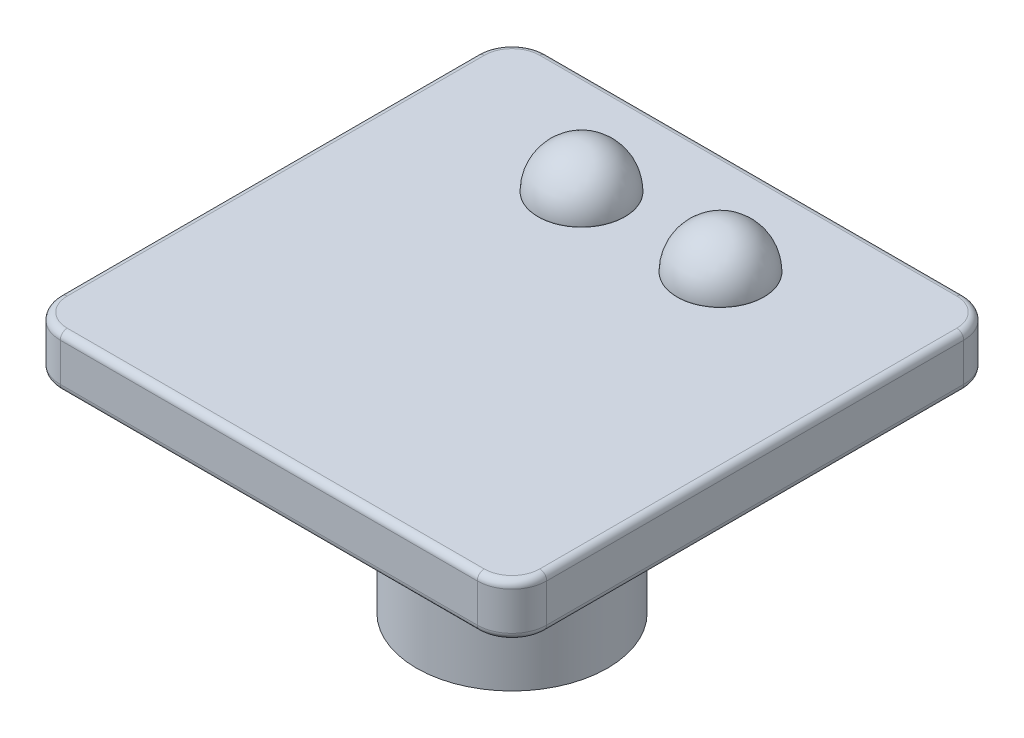
from build123d import *

# Parameters (mm, degrees)
BOSS_EXTRUDE1_DEPTH = 1.5
SKETCH2_R           = 2.75
BOSS_EXTRUDE2_DEPTH = 6
SKETCH3_W           = 1.1
SKETCH3_H           = 1.45
SKETCH3_W_2         = 1.45
SKETCH3_H_2         = 1.1
CUT_EXTRUDE1_DEPTH  = 6
CHAMFER1_SIZE       = 0.3
FILLET1_R           = 1
SKETCH4_R           = 1.25
BOSS_EXTRUDE3_DEPTH = 0.01
DOME1_FACE_RADIUS   = 1.25
DOME1_HEIGHT        = 1.25
DOME2_FACE_RADIUS   = 1.25
DOME2_HEIGHT        = 1.25
FILLET3_R           = 0.2


with BuildPart() as part:
    # Sketch1 → Boss-Extrude1 (new body)
    with BuildSketch(Plane(origin=(0, 0, 0), x_dir=(1, 0, 0), z_dir=(0, 1, 0))):
        with BuildLine():
            Line((-7.324675649, 4.396717546), (4.675324351, 4.396717546))
            ThreePointArc((4.675324351, 4.396717546), (5.382431132, 4.103824327), (5.675324351, 3.396717546))
            Line((5.675324351, 3.396717546), (5.675324351, -8.603282454))
            ThreePointArc((5.675324351, -8.603282454), (5.382431132, -9.310389235), (4.675324351, -9.603282454))
            Line((4.675324351, -9.603282454), (-7.324675649, -9.603282454))
            ThreePointArc((-7.324675649, -9.603282454), (-8.03178243, -9.310389235), (-8.324675649, -8.603282454))
            Line((-8.324675649, -8.603282454), (-8.324675649, 3.396717546))
            ThreePointArc((-8.324675649, 3.396717546), (-8.03178243, 4.103824327), (-7.324675649, 4.396717546))
        make_face()
    extrude(amount=BOSS_EXTRUDE1_DEPTH)

    # Sketch2 → Boss-Extrude2 (add)
    with BuildSketch(Plane.XZ):
        with Locations(Location((-1.324675649, 2.603282454, 0), (0, 0, 270))):
            Circle(SKETCH2_R)
    extrude(amount=BOSS_EXTRUDE2_DEPTH)

    # Sketch3 → Cut-Extrude1 (cut)
    with BuildSketch(Plane.XZ.offset(6)):
        with Locations((-1.324675649, 3.878282454)):
            Rectangle(SKETCH3_W, SKETCH3_H)
        with Locations((-0.049675649, 2.603282454)):
            Rectangle(SKETCH3_W_2, SKETCH3_H_2)
        with Locations((-1.324675649, 2.603282454)):
            Rectangle(SKETCH3_W, SKETCH3_H_2)
        with Locations((-2.599675649, 2.603282454)):
            Rectangle(SKETCH3_W_2, SKETCH3_H_2)
        with Locations((-1.324675649, 1.328282454)):
            Rectangle(SKETCH3_W, SKETCH3_H)
    extrude(amount=-CUT_EXTRUDE1_DEPTH, mode=Mode.SUBTRACT)

    # Chamfer1
    chamfer1_edges = [part.edges().sort_by_distance(p)[0] for p in [
        (-0.774675649, -6, 3.878282454),
        (-0.049675649, -6, 3.153282454),
        (0.675324351, -6, 2.603282454),
        (-0.774675649, -6, 1.328282454),
        (-2.599675649, -6, 3.153282454),
        (-1.324675649, -6, 4.603282454),
        (-1.874675649, -6, 3.878282454),
        (-3.324675649, -6, 2.603282454),
        (-2.599675649, -6, 2.053282454),
        (-1.874675649, -6, 1.328282454),
        (-1.324675649, -6, 0.603282454),
        (-0.049675649, -6, 2.053282454),
    ]]
    chamfer(chamfer1_edges, length=CHAMFER1_SIZE)

    # Fillet1
    fillet1_edges = [part.edges().sort_by_distance(p)[0] for p in [
        (-1.324675649, 0, 5.353282454),
    ]]
    fillet(fillet1_edges, radius=FILLET1_R)

    # Sketch4 → Boss-Extrude3 (add)
    with BuildSketch(Plane(origin=(0, 1.5, 0), x_dir=(1, 0, 0), z_dir=(0, 1, 0))):
        with Locations(Location((-3.324675649, 1.396717546, 0), (0, 0, 90))):
            Circle(SKETCH4_R)
        with Locations(Location((0.675324351, 1.396717546, 0), (0, 0, 90))):
            Circle(SKETCH4_R)
    extrude(amount=BOSS_EXTRUDE3_DEPTH)

    # Dome1: a dome of height H over a round flat face of radius A is a cap of a sphere of radius (A * A + H * H) / (2 * H)
    dome1_r = (DOME1_FACE_RADIUS * DOME1_FACE_RADIUS + DOME1_HEIGHT * DOME1_HEIGHT) / (2 * DOME1_HEIGHT)
    dome1_base = Plane((-3.324675649, 1.51, -1.396717546), z_dir=(0, 1, 0))
    with Locations(dome1_base.offset(DOME1_HEIGHT - dome1_r)):
        dome1_ball = Sphere(dome1_r, mode=Mode.PRIVATE)
    add(split(dome1_ball, bisect_by=dome1_base, keep=Keep.TOP, mode=Mode.PRIVATE))

    # Dome2: a dome of height H over a round flat face of radius A is a cap of a sphere of radius (A * A + H * H) / (2 * H)
    dome2_r = (DOME2_FACE_RADIUS * DOME2_FACE_RADIUS + DOME2_HEIGHT * DOME2_HEIGHT) / (2 * DOME2_HEIGHT)
    dome2_base = Plane((0.675324351, 1.51, -1.396717546), z_dir=(0, 1, 0))
    with Locations(dome2_base.offset(DOME2_HEIGHT - dome2_r)):
        dome2_ball = Sphere(dome2_r, mode=Mode.PRIVATE)
    add(split(dome2_ball, bisect_by=dome2_base, keep=Keep.TOP, mode=Mode.PRIVATE))

    # Fillet3
    fillet3_edges = [part.edges().sort_by_distance(p)[0] for p in [
        (5.382431132, 1.5, 9.310389235),
        (-1.324675649, 0, 9.603282454),
        (-8.03178243, 0, 9.310389235),
        (5.675324351, 1.5, 2.603282454),
        (5.382431132, 1.5, -4.103824327),
        (-1.324675649, 1.5, -4.396717546),
        (-8.03178243, 1.5, -4.103824327),
        (-8.324675649, 1.5, 2.603282454),
        (-8.03178243, 1.5, 9.310389235),
        (-1.324675649, 1.5, 9.603282454),
        (-8.324675649, 0, 2.603282454),
        (-8.03178243, 0, -4.103824327),
        (-1.324675649, 0, -4.396717546),
        (5.382431132, 0, -4.103824327),
        (5.675324351, 0, 2.603282454),
        (5.382431132, 0, 9.310389235),
    ]]
    fillet(fillet3_edges, radius=FILLET3_R)


solid = part.part
